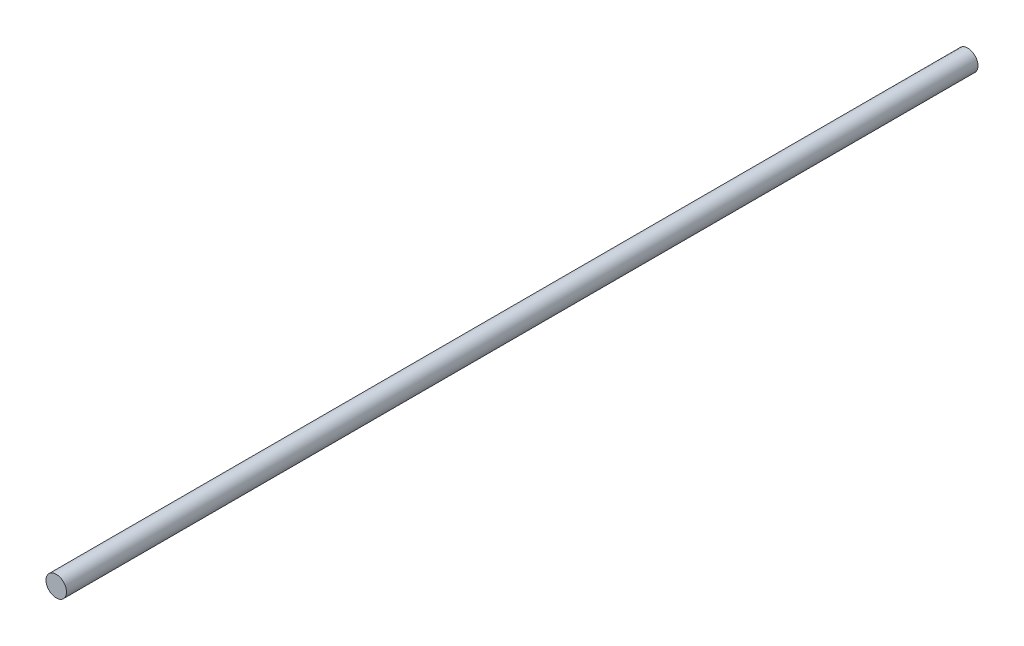
from build123d import *

# Parameters (mm, degrees)
CROQUIS1_R              = 4.5
SALIENTE_EXTRUIR1_DEPTH = 400


with BuildPart() as part:
    # Croquis1 → Saliente-Extruir1 (new body)
    with BuildSketch(Plane.XY):
        Circle(CROQUIS1_R)
    extrude(amount=SALIENTE_EXTRUIR1_DEPTH)


solid = part.part
